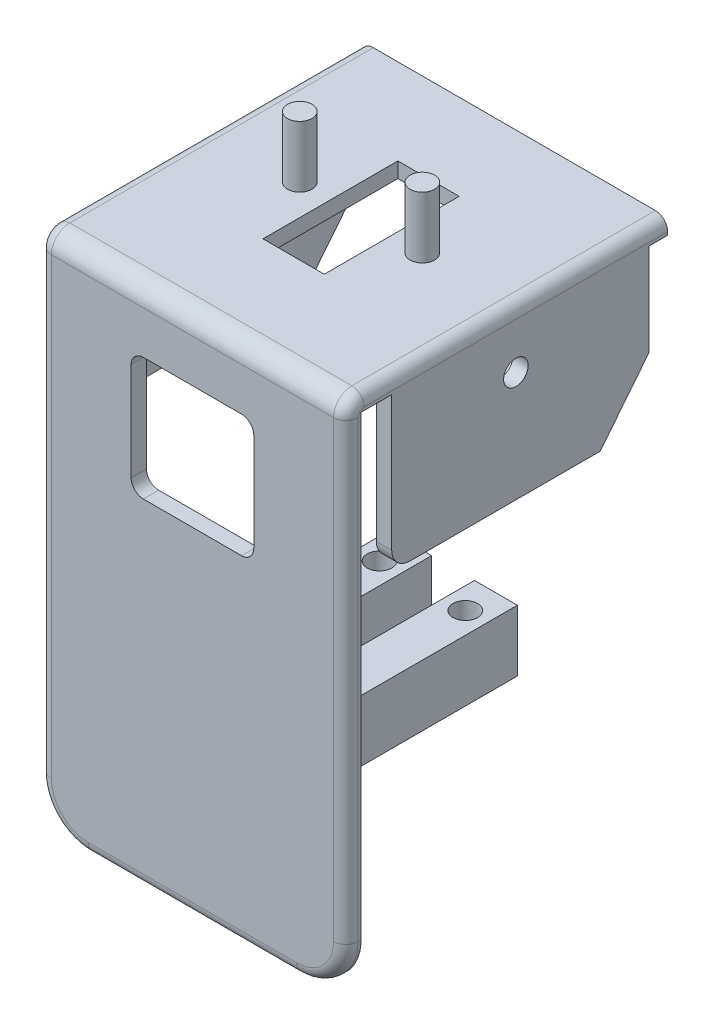
from build123d import *

# Parameters (mm, degrees)
SALIENTE_EXTRUIR1_DEPTH = 2.5
CROQUIS4_W              = 50
CROQUIS4_H              = 2.5
SALIENTE_EXTRUIR2_DEPTH = 50
REDONDEO2_R             = 3
CROQUIS6_W              = 2.5
CROQUIS6_H              = 42
SALIENTE_EXTRUIR3_DEPTH = 25
REDONDEO3_R             = 2
CORTAR_EXTRUIR1_DEPTH   = 25
CORTAR_EXTRUIR2_START   = -25
CORTAR_EXTRUIR2_DEPTH   = 25
CROQUIS11_W             = 10
CROQUIS11_H             = 22
CORTAR_EXTRUIR3_DEPTH   = 25
CROQUIS12_R             = 2
CORTAR_EXTRUIR4_DEPTH   = 25
CORTAR_EXTRUIR5_START   = -25
CROQUIS13_R             = 2
CORTAR_EXTRUIR5_DEPTH   = 25
CROQUIS14_R             = 2
SALIENTE_EXTRUIR4_DEPTH = 10
CROQUIS15_W             = 7
CROQUIS15_H             = 10
SALIENTE_EXTRUIR5_DEPTH = 40
CROQUIS17_R             = 2
CORTAR_EXTRUIR6_DEPTH   = 50
CROQUIS18_R             = 2
CORTAR_EXTRUIR7_DEPTH   = 50


with BuildPart() as part:
    # Croquis1 → Saliente-Extruir1 (new body)
    with BuildSketch(Plane.XY):
        with BuildLine():
            Line((17, -42.5), (-17, -42.5))
            ThreePointArc((-17, -42.5), (-22.656854249, -40.156854249), (-25, -34.5))
            Line((-25, -34.5), (-25, 42.5))
            Line((-25, 42.5), (25, 42.5))
            Line((25, 42.5), (25, -34.5))
            ThreePointArc((25, -34.5), (22.656854249, -40.156854249), (17, -42.5))
        make_face()
        with BuildLine():
            Line((8, 12.5), (-8, 12.5))
            ThreePointArc((-8, 12.5), (-9.414213562, 13.085786438), (-10, 14.5))
            Line((-10, 14.5), (-10, 30.5))
            ThreePointArc((-10, 30.5), (-9.414213562, 31.914213562), (-8, 32.5))
            Line((-8, 32.5), (8, 32.5))
            ThreePointArc((8, 32.5), (9.414213562, 31.914213562), (10, 30.5))
            Line((10, 30.5), (10, 14.5))
            ThreePointArc((10, 14.5), (9.414213562, 13.085786438), (8, 12.5))
        make_face(mode=Mode.SUBTRACT)
    extrude(amount=SALIENTE_EXTRUIR1_DEPTH)

    # Croquis4 → Saliente-Extruir2 (add)
    with BuildSketch(Plane(origin=(0, 0, 0), x_dir=(-1, 0, 0), z_dir=(0, 0, -1))):
        with Locations((0, 41.25)):
            Rectangle(CROQUIS4_W, CROQUIS4_H)
    extrude(amount=SALIENTE_EXTRUIR2_DEPTH)

    # Redondeo2
    redondeo2_edges = [part.edges().sort_by_distance(p)[0] for p in [
        (0, 42.5, 2.5),
    ]]
    fillet(redondeo2_edges, radius=REDONDEO2_R)

    # Croquis6 → Saliente-Extruir3 (add)
    with BuildSketch(Plane.XZ.offset(-40)):
        with Locations((-23.75, -26)):
            Rectangle(CROQUIS6_W, CROQUIS6_H)
        with Locations((23.75, -26)):
            Rectangle(CROQUIS6_W, CROQUIS6_H)
    extrude(amount=SALIENTE_EXTRUIR3_DEPTH)

    # Redondeo3
    redondeo3_edges = [part.edges().sort_by_distance(p)[0] for p in [
        (0, -42.5, 2.5),
        (22.656854249, -40.156854249, 2.5),
        (25, 2.5, 2.5),
        (-25, 2.5, 2.5),
        (-25, 42.5, -25.25),
        (-25, 41.621320344, 1.621320344),
        (25, 42.5, -25.25),
        (25, 41.621320344, 1.621320344),
        (-22.656854249, -40.156854249, 2.5),
    ]]
    fillet(redondeo3_edges, radius=REDONDEO3_R)

    # Croquis7 → Cortar-Extruir1 (cut)
    with BuildSketch(Plane(origin=(25, 0, 0), x_dir=(0, 0, -1), z_dir=(1, 0, 0))):
        Polygon((39, 15), (47, 25), (47, 15), align=None)
        with BuildLine():
            Line((5, 18), (5, 15))
            Line((5, 15), (8, 15))
            ThreePointArc((8, 15), (5.878679656, 15.878679656), (5, 18))
        make_face()
    extrude(amount=-CORTAR_EXTRUIR1_DEPTH, mode=Mode.SUBTRACT)

    # Croquis8 → Cortar-Extruir2 (cut)
    with BuildSketch(Plane.ZY.offset(25).offset(CORTAR_EXTRUIR2_START)):
        Polygon((-39, 15), (-47, 15), (-47, 25), align=None)
        with BuildLine():
            Line((-5, 18), (-5, 15))
            Line((-5, 15), (-8, 15))
            ThreePointArc((-8, 15), (-5.878679656, 15.878679656), (-5, 18))
        make_face()
    extrude(amount=CORTAR_EXTRUIR2_DEPTH, mode=Mode.SUBTRACT)

    # Croquis11 → Cortar-Extruir3 (cut)
    with BuildSketch(Plane.XZ.offset(-40)):
        with Locations((0, -25)):
            Rectangle(CROQUIS11_W, CROQUIS11_H)
    extrude(amount=-CORTAR_EXTRUIR3_DEPTH, mode=Mode.SUBTRACT)

    # Croquis12 → Cortar-Extruir4 (cut)
    with BuildSketch(Plane.ZY.offset(25)):
        with Locations(Location((-25.25, 33, 0), (0, 0, 270))):
            Circle(CROQUIS12_R)
    extrude(amount=-CORTAR_EXTRUIR4_DEPTH, mode=Mode.SUBTRACT)

    # Croquis13 → Cortar-Extruir5 (cut)
    with BuildSketch(Plane(origin=(25, 0, 0), x_dir=(0, 0, -1), z_dir=(1, 0, 0)).offset(CORTAR_EXTRUIR5_START)):
        with Locations(Location((25.25, 33, 0), (0, 0, 270))):
            Circle(CROQUIS13_R)
    extrude(amount=CORTAR_EXTRUIR5_DEPTH, mode=Mode.SUBTRACT)

    # Croquis14 → Saliente-Extruir4 (add)
    with BuildSketch(Plane(origin=(0, 42.5, 0), x_dir=(1, 0, 0), z_dir=(0, 1, 0))):
        with Locations(Location((-10, 25, 0), (0, 0, 90))):
            Circle(CROQUIS14_R)
        with Locations(Location((10, 25, 0), (0, 0, 90))):
            Circle(CROQUIS14_R)
    extrude(amount=SALIENTE_EXTRUIR4_DEPTH)

    # Croquis15 → Saliente-Extruir5 (add)
    with BuildSketch(Plane(origin=(0, 0, 0), x_dir=(-1, 0, 0), z_dir=(0, 0, -1))):
        with Locations((-7, -19.5)):
            Rectangle(CROQUIS15_W, CROQUIS15_H)
        with Locations((7, -19.5)):
            Rectangle(CROQUIS15_W, CROQUIS15_H)
    extrude(amount=SALIENTE_EXTRUIR5_DEPTH)

    # Croquis17 → Cortar-Extruir6 (cut)
    with BuildSketch(Plane(origin=(0, -14.5, 0), x_dir=(1, 0, 0), z_dir=(0, 1, 0))):
        with Locations(Location((-7, 35, 0), (0, 0, 270))):
            Circle(CROQUIS17_R)
    extrude(amount=-CORTAR_EXTRUIR6_DEPTH, mode=Mode.SUBTRACT)

    # Croquis18 → Cortar-Extruir7 (cut)
    with BuildSketch(Plane(origin=(0, -14.5, 0), x_dir=(1, 0, 0), z_dir=(0, 1, 0))):
        with Locations(Location((7, 35, 0), (0, 0, 270))):
            Circle(CROQUIS18_R)
    extrude(amount=-CORTAR_EXTRUIR7_DEPTH, mode=Mode.SUBTRACT)


solid = part.part
